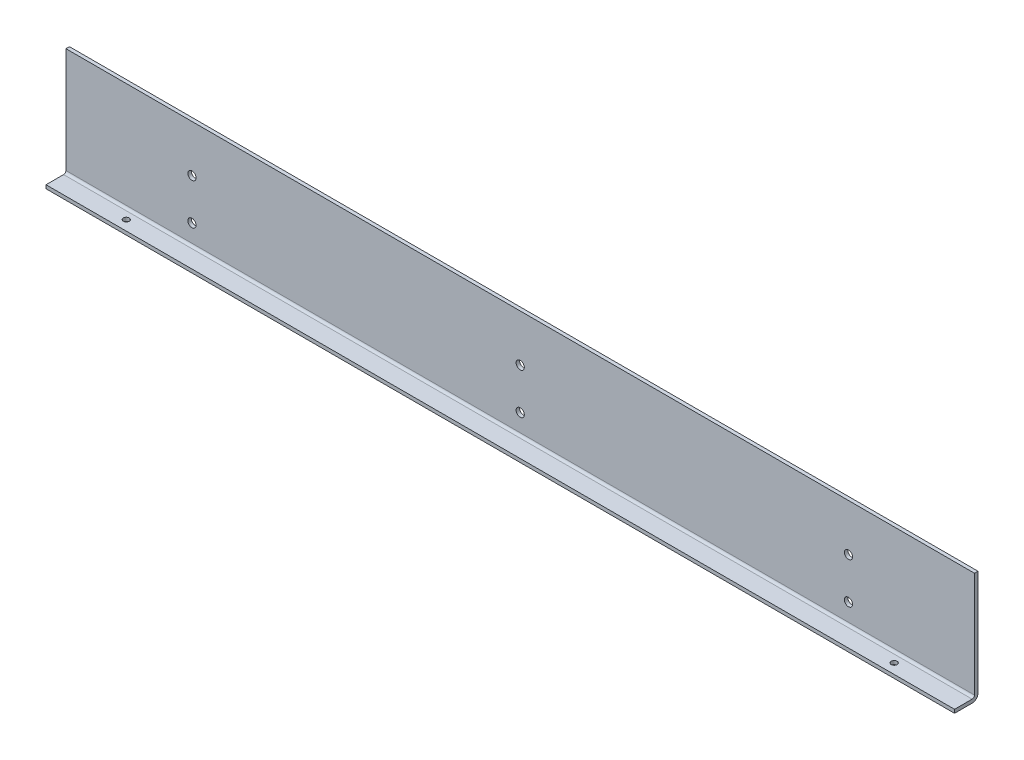
from build123d import *

# Parameters (mm, degrees)
SKETCH_1_W          = 775
SKETCH_1_H          = 95
EXTRUDE_1_DEPTH     = 3
SKETCH_2_W          = 775
SKETCH_2_H          = 3
EXTRUDE_2_DEPTH     = 17
SKETCH_3_R          = 3.5
CUT_EXTRUDE_1_DEPTH = 17
SKETCH_4_R          = 2.5
CUT_EXTRUDE_2_DEPTH = 17
FILLET_1_R          = 5
FILLET_2_R          = 2


with BuildPart() as part:
    # 스케치1 → 보스-돌출1 (new body)
    with BuildSketch(Plane.XY):
        with Locations((387.5, 47.5)):
            Rectangle(SKETCH_1_W, SKETCH_1_H)
    extrude(amount=EXTRUDE_1_DEPTH)

    # 스케치2 → 보스-돌출2 (add)
    with BuildSketch(Plane.XY.offset(3)):
        with Locations((387.5, 1.5)):
            Rectangle(SKETCH_2_W, SKETCH_2_H)
    extrude(amount=EXTRUDE_2_DEPTH)

    # 스케치3 → 컷-돌출1 (cut)
    with BuildSketch(Plane.XY.offset(3)):
        with Locations((107.5, 55)):
            Circle(SKETCH_3_R)
        with Locations((107.5, 20)):
            Circle(SKETCH_3_R)
        with Locations((387.5, 55)):
            Circle(SKETCH_3_R)
        with Locations((387.5, 20)):
            Circle(SKETCH_3_R)
        with Locations((667.5, 55)):
            Circle(SKETCH_3_R)
        with Locations((667.5, 20)):
            Circle(SKETCH_3_R)
    extrude(amount=-CUT_EXTRUDE_1_DEPTH, mode=Mode.SUBTRACT)

    # 스케치4 → 컷-돌출2 (cut)
    with BuildSketch(Plane(origin=(0, 3, 0), x_dir=(1, 0, 0), z_dir=(0, 1, 0))):
        with Locations(Location((60, -11.5, 0), (0, 0, 270))):
            Circle(SKETCH_4_R)
        with Locations(Location((715, -11.5, 0), (0, 0, 270))):
            Circle(SKETCH_4_R)
    extrude(amount=-CUT_EXTRUDE_2_DEPTH, mode=Mode.SUBTRACT)

    # 필렛1
    fillet_1_edges = [part.edges().sort_by_distance(p)[0] for p in [
        (387.5, 0, 0),
    ]]
    fillet(fillet_1_edges, radius=FILLET_1_R)

    # 필렛2
    fillet_2_edges = [part.edges().sort_by_distance(p)[0] for p in [
        (387.5, 3, 3),
    ]]
    fillet(fillet_2_edges, radius=FILLET_2_R)


solid = part.part
